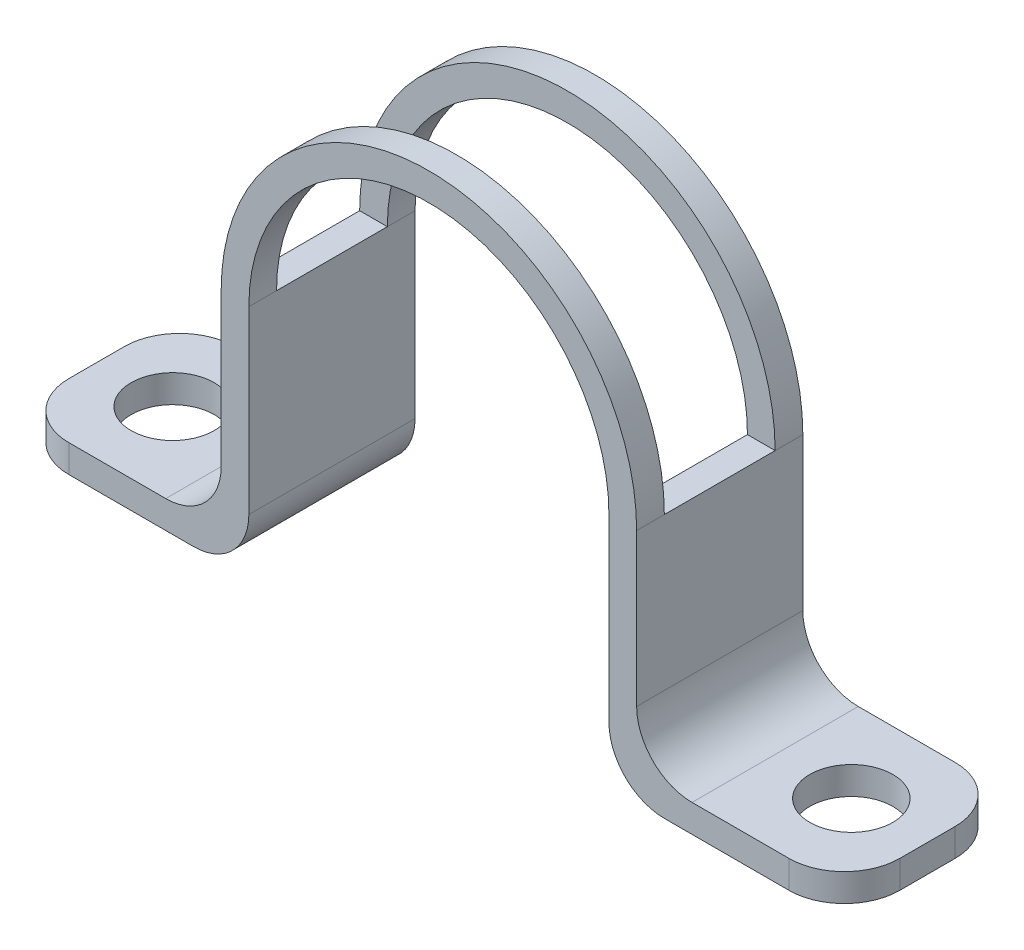
from build123d import *

# Parameters (mm, degrees)
BOSS_EXTRUDE1_DEPTH     = 6
SKETCH2_R               = 1.5
CUT_EXTRUDE1_DEPTH      = 6
CUT_EXTRUDE2_DEPTH      = 12
CUT_EXTRUDE2_DEPTH_BACK = 17
SKETCH3_W               = 4
SKETCH3_H               = 10
FILLET1_R               = 2


with BuildPart() as part:
    # Sketch1 → Boss-Extrude1 (new body)
    with BuildSketch(Plane.XY):
        with BuildLine():
            Line((-15, 0), (-9.5, 0))
            ThreePointArc((-9.5, 0), (-8.085786438, 0.585786438), (-7.5, 2))
            Line((-7.5, 2), (-7.5, 7.5))
            ThreePointArc((-7.5, 7.5), (0, 15), (7.5, 7.5))
            Line((7.5, 7.5), (7.5, 2))
            ThreePointArc((7.5, 2), (8.085786438, 0.585786438), (9.5, 0))
            Line((9.5, 0), (15, 0))
            Line((15, 0), (15, -1))
            Line((15, -1), (8.5, -1))
            ThreePointArc((8.5, -1), (7.085786438, -0.414213562), (6.5, 1))
            Line((6.5, 1), (6.5, 7.5))
            ThreePointArc((6.5, 7.5), (0, 14), (-6.5, 7.5))
            Line((-6.5, 7.5), (-6.5, 1))
            ThreePointArc((-6.5, 1), (-7.085786438, -0.414213562), (-8.5, -1))
            Line((-8.5, -1), (-15, -1))
            Line((-15, -1), (-15, 0))
        make_face()
    extrude(amount=BOSS_EXTRUDE1_DEPTH)

    # Sketch2 → Cut-Extrude1 (cut)
    with BuildSketch(Plane(origin=(0, 0, 0), x_dir=(1, 0, 0), z_dir=(0, 1, 0))):
        with Locations(Location((12.25, -3, 0), (0, 0, 270))):
            Circle(SKETCH2_R)
        with Locations(Location((-12.25, -3, 0), (0, 0, 180))):
            Circle(SKETCH2_R)
    extrude(amount=-CUT_EXTRUDE1_DEPTH, mode=Mode.SUBTRACT)

    # Sketch3 → Cut-Extrude2 (cut, two sides: drawn at the far end of the back side and taken through both)
    with BuildSketch(Plane(origin=(0, 0, 0), x_dir=(0, 0, -1), z_dir=(1, 0, 0)).offset(-CUT_EXTRUDE2_DEPTH_BACK)):
        with Locations((-3, 12.5)):
            Rectangle(SKETCH3_W, SKETCH3_H)
    extrude(amount=CUT_EXTRUDE2_DEPTH + CUT_EXTRUDE2_DEPTH_BACK, mode=Mode.SUBTRACT)

    # Fillet1
    fillet1_edges = [part.edges().sort_by_distance(p)[0] for p in [
        (15, -0.5, 0),
        (-15, -0.5, 0),
        (15, -0.5, 6),
        (-15, -0.5, 6),
    ]]
    fillet(fillet1_edges, radius=FILLET1_R)


solid = part.part
